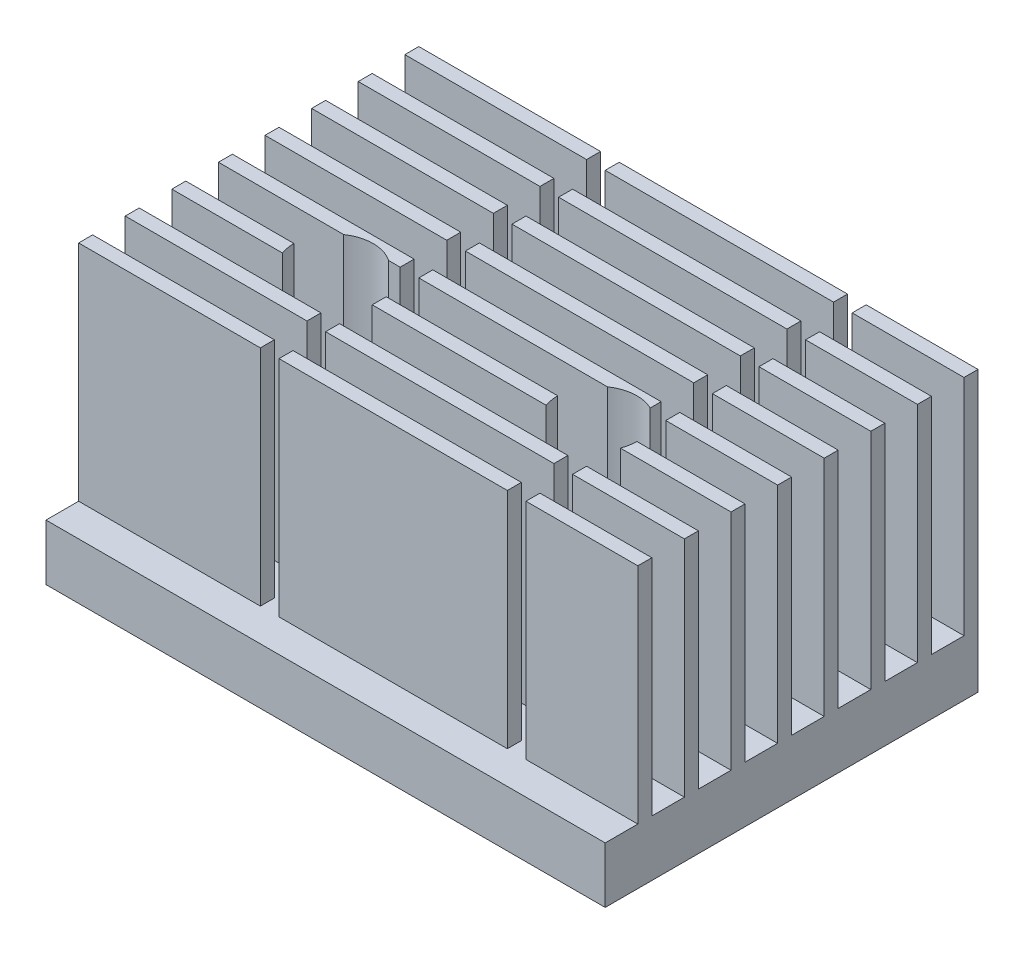
from build123d import *

# Parameters (mm, degrees)
SKETCH_1_W          = 60
SKETCH_1_H          = 40
EXTRUDE_1_DEPTH     = 30
SKETCH_2_W          = 60
SKETCH_2_H          = 3.5
CUT_EXTRUDE_1_DEPTH = 24
SKETCH_3_W          = 2
SKETCH_3_H          = 40
CUT_EXTRUDE_2_DEPTH = 24
SKETCH_4_R          = 2.25
CUT_EXTRUDE_3_DEPTH = 47.904157598
SKETCH_5_R          = 4.25
CUT_EXTRUDE_4_DEPTH = 24


with BuildPart() as part:
    # 草图1 → 拉伸1 (new body)
    with BuildSketch(Plane(origin=(0, 0, 0), x_dir=(1, 0, 0), z_dir=(0, 1, 0))):
        Rectangle(SKETCH_1_W, SKETCH_1_H)
    extrude(amount=EXTRUDE_1_DEPTH)

    # 草图2 → 切除-拉伸1 (cut)
    with BuildSketch(Plane(origin=(0, 30, 0), x_dir=(-1, 0, 0), z_dir=(0, 1, 0))):
        with Locations((0, -16.75)):
            Rectangle(SKETCH_2_W, SKETCH_2_H)
        with Locations((0, -11.75)):
            Rectangle(SKETCH_2_W, SKETCH_2_H)
        with Locations((0, -6.75)):
            Rectangle(SKETCH_2_W, SKETCH_2_H)
        with Locations((0, -1.75)):
            Rectangle(SKETCH_2_W, SKETCH_2_H)
        with Locations((0, 3.25)):
            Rectangle(SKETCH_2_W, SKETCH_2_H)
        with Locations((0, 8.25)):
            Rectangle(SKETCH_2_W, SKETCH_2_H)
        with Locations((0, 13.25)):
            Rectangle(SKETCH_2_W, SKETCH_2_H)
        with Locations((0, 18.25)):
            Rectangle(SKETCH_2_W, SKETCH_2_H)
    extrude(amount=-CUT_EXTRUDE_1_DEPTH, mode=Mode.SUBTRACT)

    # 草图3 → 切除-拉伸2 (cut)
    with BuildSketch(Plane(origin=(0, 30, 0), x_dir=(-1, 0, 0), z_dir=(0, 1, 0))):
        with Locations((-17, 0)):
            Rectangle(SKETCH_3_W, SKETCH_3_H)
        with Locations((9.5, 0)):
            Rectangle(SKETCH_3_W, SKETCH_3_H)
    extrude(amount=-CUT_EXTRUDE_2_DEPTH, mode=Mode.SUBTRACT)

    # 草图4 → 切除-拉伸3 (cut, through all)
    with BuildSketch(Plane.XZ):
        with Locations(Location((14.15, 5, 0), (0, 0, 270))):
            Circle(SKETCH_4_R)
        with Locations(Location((-14.15, 5, 0), (0, 0, 180))):
            Circle(SKETCH_4_R)
    extrude(amount=-CUT_EXTRUDE_3_DEPTH, mode=Mode.SUBTRACT)

    # 草图5 → 切除-拉伸4 (cut)
    with BuildSketch(Plane(origin=(0, 30, 0), x_dir=(-1, 0, 0), z_dir=(0, 1, 0))):
        with Locations((14.15, 5)):
            Circle(SKETCH_5_R)
        with Locations((-14.15, 5)):
            Circle(SKETCH_5_R)
    extrude(amount=-CUT_EXTRUDE_4_DEPTH, mode=Mode.SUBTRACT)


solid = part.part
